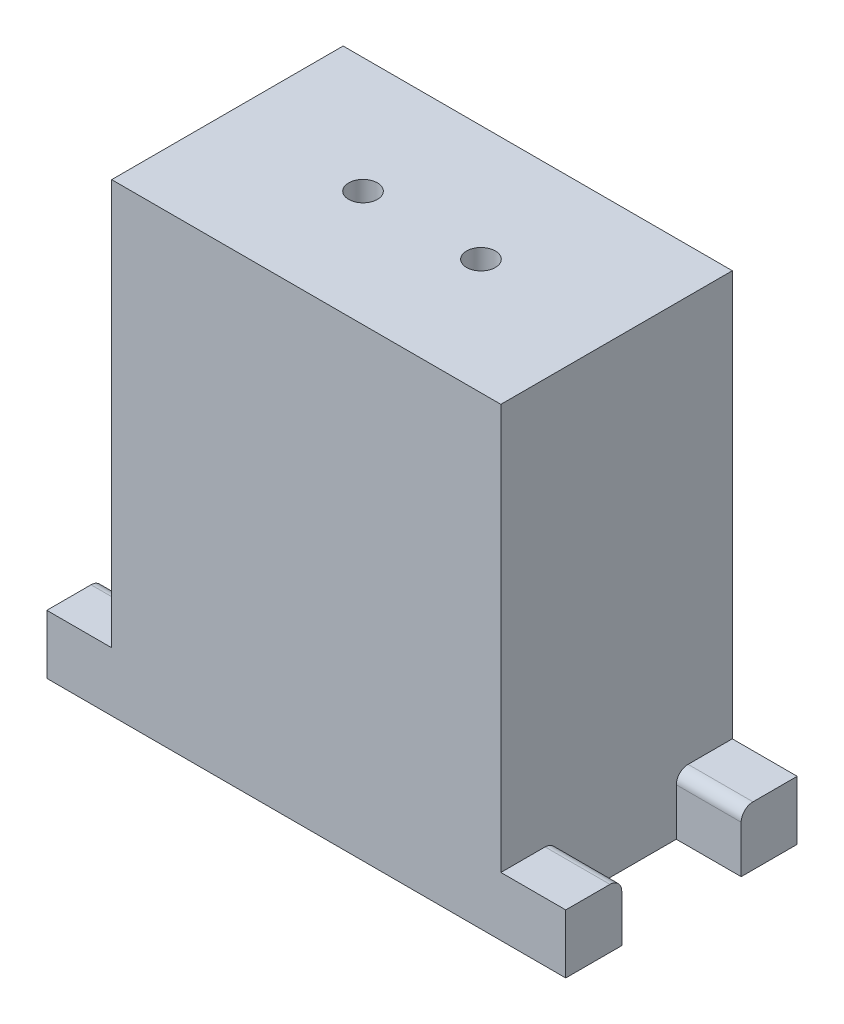
from build123d import *

# Parameters (mm, degrees)
SKETCH_1_W          = 26.4
SKETCH_1_H          = 15.7
EXTRUDE_1_DEPTH     = 31.5
SKETCH_2_W          = 3.8
SKETCH_2_H          = 4
EXTRUDE_2_DEPTH     = 4.4
SKETCH_3_W          = 3.8
SKETCH_3_H          = 4
EXTRUDE_3_DEPTH     = 4.4
SKETCH_4_R          = 0.975
CUT_EXTRUDE_1_DEPTH = 37.92739498
FILLET_1_R          = 0.8


with BuildPart() as part:
    # ｽｹｯﾁ1 → ﾎﾞｽ - 押し出し1 (new body)
    with BuildSketch(Plane(origin=(0, 0, 0), x_dir=(1, 0, 0), z_dir=(0, 1, 0))):
        Rectangle(SKETCH_1_W, SKETCH_1_H)
    extrude(amount=EXTRUDE_1_DEPTH)

    # ｽｹｯﾁ2 → ﾎﾞｽ - 押し出し2 (add)
    with BuildSketch(Plane(origin=(13.2, 0, 0), x_dir=(0, 0, -1), z_dir=(1, 0, 0))):
        with Locations((-5.95, 2)):
            Rectangle(SKETCH_2_W, SKETCH_2_H)
        with Locations((5.95, 2)):
            Rectangle(SKETCH_2_W, SKETCH_2_H)
    extrude(amount=EXTRUDE_2_DEPTH)

    # ｽｹｯﾁ3 → ﾎﾞｽ - 押し出し3 (add)
    with BuildSketch(Plane.ZY.offset(13.2)):
        with Locations((5.95, 2)):
            Rectangle(SKETCH_3_W, SKETCH_3_H)
        with Locations((-5.95, 2)):
            Rectangle(SKETCH_3_W, SKETCH_3_H)
    extrude(amount=EXTRUDE_3_DEPTH)

    # ｽｹｯﾁ4 → ｶｯﾄ - 押し出し1 (cut, through all)
    with BuildSketch(Plane.XZ):
        with Locations(Location((4, 0, 0), (0, 0, 270))):
            Circle(SKETCH_4_R)
        with Locations(Location((-4, 0, 0), (0, 0, 270))):
            Circle(SKETCH_4_R)
    extrude(amount=-CUT_EXTRUDE_1_DEPTH, mode=Mode.SUBTRACT)

    # ﾌｨﾚｯﾄ1
    fillet_1_edges = [part.edges().sort_by_distance(p)[0] for p in [
        (15.4, 4, 4.05),
        (15.4, 4, -4.05),
        (-15.4, 4, 4.05),
        (-15.4, 4, -4.05),
    ]]
    fillet(fillet_1_edges, radius=FILLET_1_R)


solid = part.part
